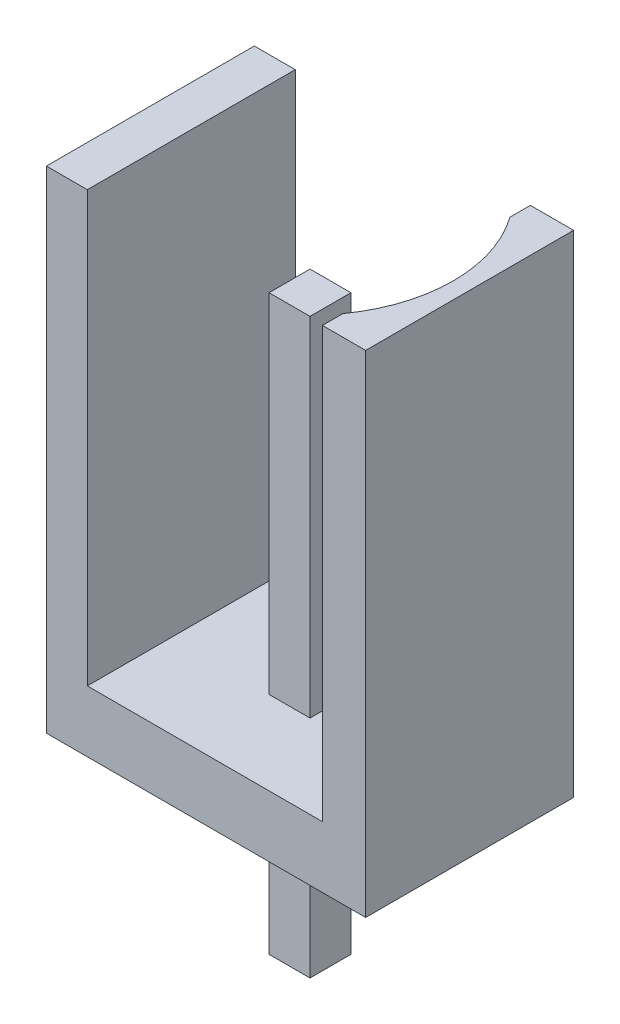
from build123d import *

# Parameters (mm, degrees)
SKETCH_1_W             = 7.8
SKETCH_1_H             = 5.08
EXTRUDE_1_DEPTH        = 12
CUT_EXTRUDE_1_DEPTH    = 10.5
EXTRUDE_1_2_DEPTH      = 4
EXTRUDE_1_2_DEPTH_BACK = 10
SKETCH_4_W             = 1
SKETCH_4_H             = 1


with BuildPart() as part:
    # 草图1 → Extrude 1 (new body)
    with BuildSketch(Plane(origin=(0, 0, 0), x_dir=(1, 0, 0), z_dir=(0, 1, 0))):
        Rectangle(SKETCH_1_W, SKETCH_1_H)
    extrude(amount=EXTRUDE_1_DEPTH)

    # 草图2 → 切除-拉伸1 (cut)
    with BuildSketch(Plane(origin=(0, 12, 0), x_dir=(-1, 0, 0), z_dir=(0, 1, 0))):
        with BuildLine():
            Line((-2.844011252, 2.04), (-2.844011252, 2.54))
            Line((-2.844011252, 2.54), (2.9, 2.54))
            Line((2.9, 2.54), (2.9, -2.54))
            Line((2.9, -2.54), (-2.844011252, -2.54))
            Line((-2.844011252, -2.54), (-2.844011252, -2.04))
            ThreePointArc((-2.844011252, -2.04), (-3.5, 0), (-2.844011252, 2.04))
        make_face()
    extrude(amount=-CUT_EXTRUDE_1_DEPTH, mode=Mode.SUBTRACT)

    # 草图4 → Extrude 1 2 (add, two sides: drawn at the far end of the back side and taken through both)
    with BuildSketch(Plane.XZ.offset(-EXTRUDE_1_2_DEPTH_BACK)):
        Rectangle(SKETCH_4_W, SKETCH_4_H)
    extrude(amount=EXTRUDE_1_2_DEPTH + EXTRUDE_1_2_DEPTH_BACK)


solid = part.part
